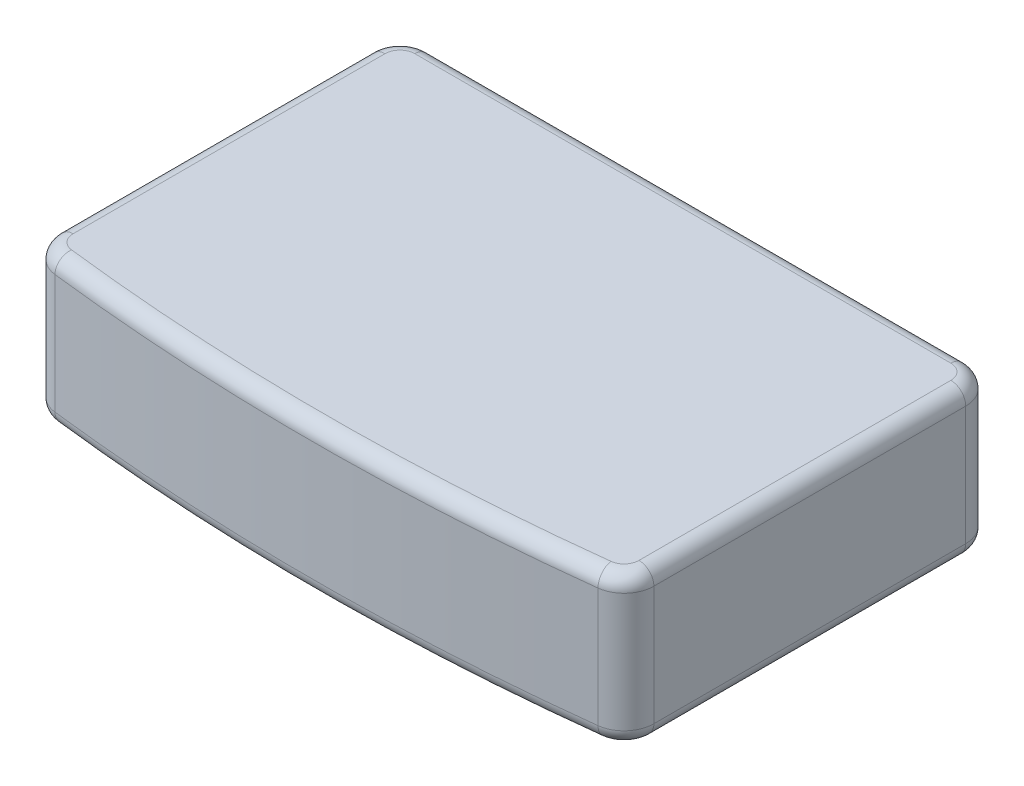
from build123d import *

# Parameters (mm, degrees)
BOSS_EXTRUDE1_DEPTH = 5
SKETCH1_3_R         = 1.5
CUT_EXTRUDE1_DEPTH  = 3
FILLET1_R           = 1
FILLET2_R           = 0.5


with BuildPart() as part:
    # Sketch1 → Boss-Extrude1 (new body)
    with BuildSketch(Plane(origin=(0, 0, 0), x_dir=(1, 0, 0), z_dir=(0, 1, 0))):
        with BuildLine():
            Line((0.5, 0.643681577), (0.5, 13))
            Line((0.5, 13), (20.5, 13))
            Line((20.5, 13), (20.5, 0.643681577))
            ThreePointArc((20.5, 0.643681577), (10.5, 0), (0.5, 0.643681577))
        make_face()
    extrude(amount=BOSS_EXTRUDE1_DEPTH)

    # Sketch1<3> → Cut-Extrude1 (cut)
    with BuildSketch(Plane(origin=(0, 0, 0), x_dir=(1, 0, 0), z_dir=(0, 1, 0))):
        with Locations((5.5, 9)):
            Circle(SKETCH1_3_R)
        with Locations((15.5, 9)):
            Circle(SKETCH1_3_R)
    extrude(amount=CUT_EXTRUDE1_DEPTH, mode=Mode.SUBTRACT)

    # Fillet1
    fillet1_edges = [part.edges().sort_by_distance(p)[0] for p in [
        (20.5, 2.5, -13),
        (0.5, 2.5, -13),
        (20.5, 2.5, -0.643681577),
        (0.5, 2.5, -0.643681577),
    ]]
    fillet(fillet1_edges, radius=FILLET1_R)

    # Fillet2
    fillet2_edges = [part.edges().sort_by_distance(p)[0] for p in [
        (0.792893219, 0, -12.707106781),
        (0.5, 0, -6.763891411),
        (20.5, 0, -6.763891411),
        (20.207106781, 0, -12.707106781),
        (0.792893219, 5, -12.707106781),
        (0.5, 5, -6.763891411),
        (20.5, 5, -6.763891411),
        (20.207106781, 5, -12.707106781),
        (10.5, 0, -13),
        (10.5, 5, -13),
        (0.752710526, 0, -0.863284184),
        (10.5, 0, 0),
        (20.247289474, 0, -0.863284184),
        (0.752710526, 5, -0.863284184),
        (10.5, 5, 0),
        (20.247289474, 5, -0.863284184),
    ]]
    fillet(fillet2_edges, radius=FILLET2_R)


solid = part.part
